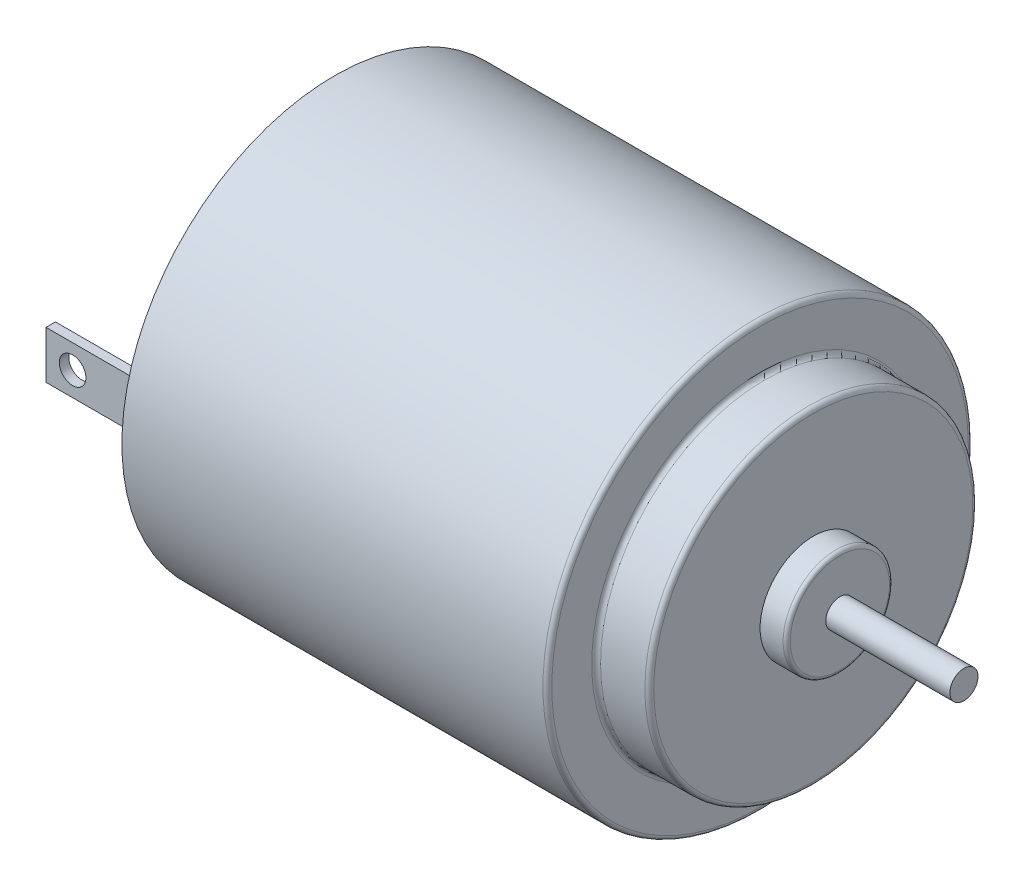
from build123d import *

# Parameters (mm, degrees)
BOSS_EXTRUDE1_DEPTH      = 12
BOSS_EXTRUDE1_DEPTH_BACK = 12
SKETCH1_R                = 12
SKETCH2_R                = 9.25
BOSS_EXTRUDE2_DEPTH      = 3
SKETCH3_R                = 3
BOSS_EXTRUDE3_DEPTH      = 1.5
SKETCH4_R                = 0.79375
BOSS_EXTRUDE4_DEPTH      = 7
FILLET1_R                = 0.25
FILLET2_R                = 0.2
SKETCH5_W                = 0.5328248
SKETCH5_H                = 2.687879882
BOSS_EXTRUDE5_DEPTH      = 6.5
SKETCH7_R                = 0.75
CUT_EXTRUDE1_DEPTH       = 35.216099373


with BuildPart() as part:
    # Sketch1 → Boss-Extrude1 (new, two sides: drawn at the far end of the back side and taken through both)
    with BuildSketch(Plane(origin=(0, 0, 0), x_dir=(0, 0, -1), z_dir=(1, 0, 0)).offset(-BOSS_EXTRUDE1_DEPTH_BACK)):
        Circle(SKETCH1_R)
    extrude(amount=BOSS_EXTRUDE1_DEPTH + BOSS_EXTRUDE1_DEPTH_BACK)

    # Sketch2 → Boss-Extrude2 (add)
    with BuildSketch(Plane(origin=(12, 0, 0), x_dir=(0, 0, -1), z_dir=(1, 0, 0))):
        Circle(SKETCH2_R)
    extrude(amount=BOSS_EXTRUDE2_DEPTH)

    # Sketch3 → Boss-Extrude3 (add)
    with BuildSketch(Plane(origin=(15, 0, 0), x_dir=(0, 0, -1), z_dir=(1, 0, 0))):
        Circle(SKETCH3_R)
    extrude(amount=BOSS_EXTRUDE3_DEPTH)

    # Sketch4 → Boss-Extrude4 (add)
    with BuildSketch(Plane(origin=(16.5, 0, 0), x_dir=(0, 0, -1), z_dir=(1, 0, 0))):
        Circle(SKETCH4_R)
    extrude(amount=BOSS_EXTRUDE4_DEPTH)

    # Fillet1
    fillet1_edges = [part.edges().sort_by_distance(p)[0] for p in [
        (15, 0, 9.25),
        (12, 0, 9.25),
        (12, 0, 12),
    ]]
    fillet(fillet1_edges, radius=FILLET1_R)

    # Fillet2
    fillet2_edges = [part.edges().sort_by_distance(p)[0] for p in [
        (16.5, 0, 3),
    ]]
    fillet(fillet2_edges, radius=FILLET2_R)

    # Sketch5 → Boss-Extrude5 (add)
    with BuildSketch(Plane.ZY.offset(12)):
        with Locations((9.5164124, 0)):
            Rectangle(SKETCH5_W, SKETCH5_H)
    boss_extrude5 = extrude(amount=BOSS_EXTRUDE5_DEPTH)

    # Mirror1: Boss-Extrude5 across plane
    add(boss_extrude5.mirror(Plane.XY))

    # Sketch7 → Cut-Extrude1 (cut, through all)
    with BuildSketch(Plane.XY.offset(9.7828248)):
        with Locations((-17, 0)):
            Circle(SKETCH7_R)
    extrude(amount=-CUT_EXTRUDE1_DEPTH, mode=Mode.SUBTRACT)


solid = part.part
